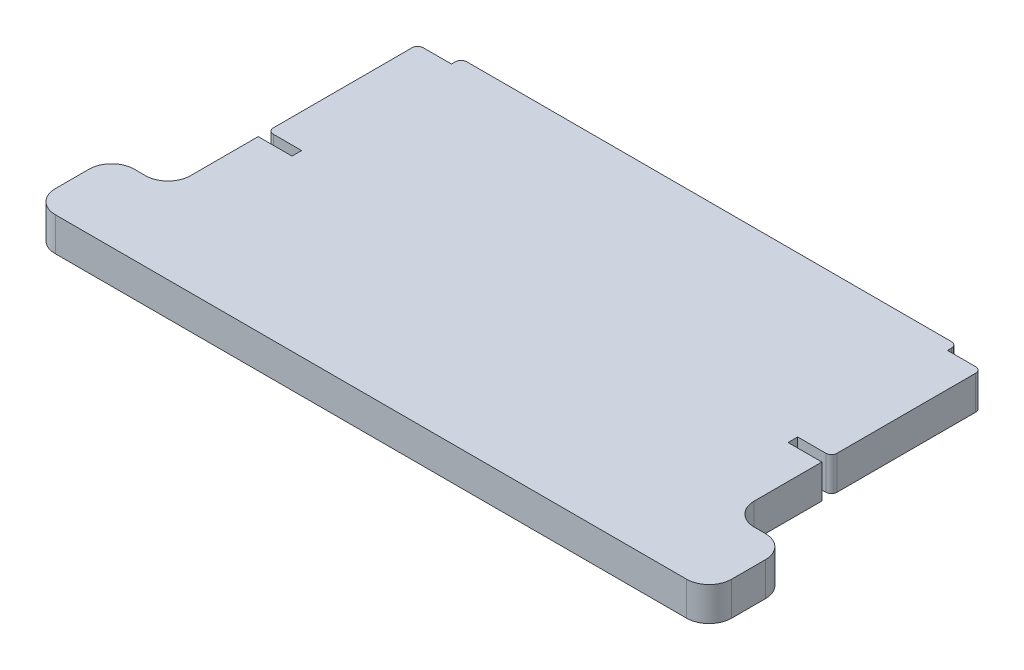
from build123d import *

# Parameters (mm, degrees)
BOSS_EXTRUDE1_DEPTH     = 1.5
CUT_EXTRUDE1_DEPTH      = 34.674916481
CUT_EXTRUDE1_DEPTH_BACK = 34.674916481
FILLET1_R               = 2
FILLET2_R               = 0.5


with BuildPart() as part:
    # Sketch1 → Boss-Extrude1 (new, symmetric)
    with BuildSketch(Plane(origin=(0, 0, 0), x_dir=(1, 0, 0), z_dir=(0, 1, 0))):
        Polygon((-25, -15), (-30, -15), (-30, -8), (-25, -8), (-25, 15), (25, 15), (25, -8), (30, -8), (30, -15), (25, -15), align=None)
    extrude(amount=BOSS_EXTRUDE1_DEPTH, both=True)

    # Sketch2 → Cut-Extrude1 (cut, two sides: drawn at the far end of the back side and taken through both)
    with BuildSketch(Plane(origin=(0, 1.5, 0), x_dir=(1, 0, 0), z_dir=(0, 1, 0)).offset(-CUT_EXTRUDE1_DEPTH_BACK)):
        with BuildLine():
            Line((-25, 14.146806682), (-22, 14.146806682))
            Line((-22, 14.146806682), (-22, 15))
            Line((-22, 15), (-25, 15))
            ThreePointArc((-25, 15), (-30.216117819, 7.5), (-25, 0))
            Line((-25, 0), (-22, 0))
            Line((-22, 0), (-22, 0.853193318))
            Line((-22, 0.853193318), (-25, 0.853193318))
            ThreePointArc((-25, 0.853193318), (-29.422367819, 7.5), (-25, 14.146806682))
        make_face()
        with BuildLine():
            Line((22, 0.853193318), (22, 0))
            Line((22, 0), (25, 0))
            ThreePointArc((25, 0), (30.216117819, 7.5), (25, 15))
            Line((25, 15), (22, 15))
            Line((22, 15), (22, 14.146806682))
            Line((22, 14.146806682), (25, 14.146806682))
            ThreePointArc((25, 14.146806682), (29.422367819, 7.5), (25, 0.853193318))
            Line((25, 0.853193318), (22, 0.853193318))
        make_face()
    extrude(amount=CUT_EXTRUDE1_DEPTH + CUT_EXTRUDE1_DEPTH_BACK, mode=Mode.SUBTRACT)

    # Fillet1
    fillet1_edges = [part.edges().sort_by_distance(p)[0] for p in [
        (25, 0, 8),
        (30, 0, 8),
        (30, 0, 15),
        (-30, 0, 15),
        (-30, 0, 8),
        (-25, 0, 8),
    ]]
    fillet(fillet1_edges, radius=FILLET1_R)

    # Fillet2
    fillet2_edges = [part.edges().sort_by_distance(p)[0] for p in [
        (-25, 0, -14.146806682),
        (-25, 0, -0.853193318),
        (25, 0, -14.146806682),
        (25, 0, -0.853193318),
        (-22, 0, -15),
        (22, 0, -15),
    ]]
    fillet(fillet2_edges, radius=FILLET2_R)


solid = part.part
